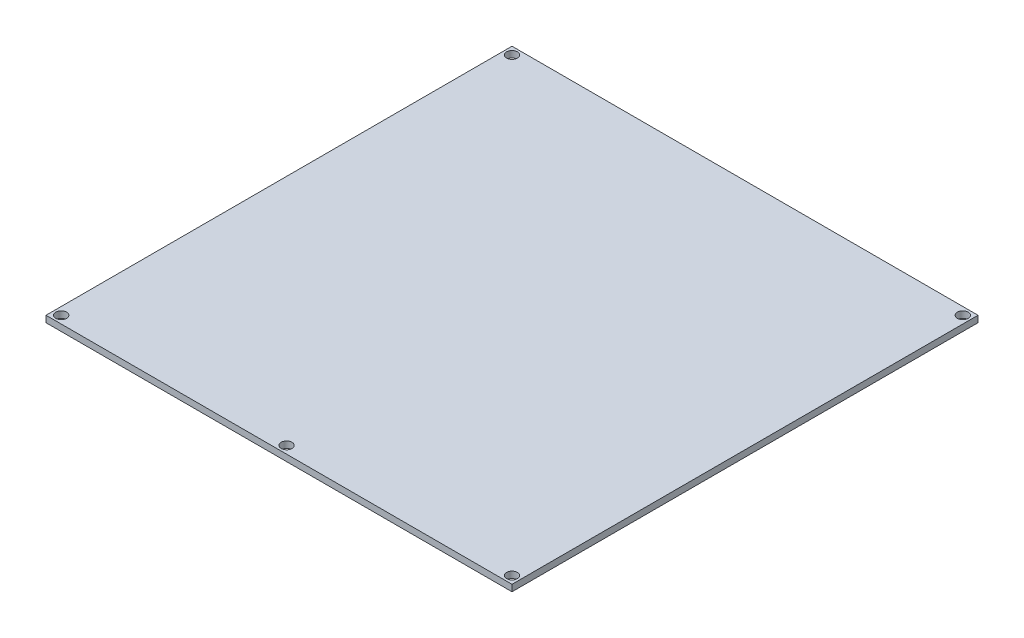
from build123d import *

# Parameters (mm, degrees)
SKETCH1_W           = 215
SKETCH1_H           = 215
SKETCH1_R           = 2.5
BOSS_EXTRUDE1_DEPTH = 3


with BuildPart() as part:
    # Sketch1 → Boss-Extrude1 (new body)
    with BuildSketch(Plane(origin=(0, 0, 0), x_dir=(1, 0, 0), z_dir=(0, 1, 0))):
        with Locations((107.5, 107.5)):
            Rectangle(SKETCH1_W, SKETCH1_H)
        with Locations(Location((3.5, 211.5, 0), (0, 0, 270))):
            Circle(SKETCH1_R, mode=Mode.SUBTRACT)
        with Locations(Location((3.5, 3.5, 0), (0, 0, 270))):
            Circle(SKETCH1_R, mode=Mode.SUBTRACT)
        with Locations(Location((211.5, 3.5, 0), (0, 0, 270))):
            Circle(SKETCH1_R, mode=Mode.SUBTRACT)
        with Locations(Location((211.5, 211.5, 0), (0, 0, 270))):
            Circle(SKETCH1_R, mode=Mode.SUBTRACT)
        with Locations(Location((107.5, 3.5, 0), (0, 0, 270))):
            Circle(SKETCH1_R, mode=Mode.SUBTRACT)
    extrude(amount=BOSS_EXTRUDE1_DEPTH)


solid = part.part
